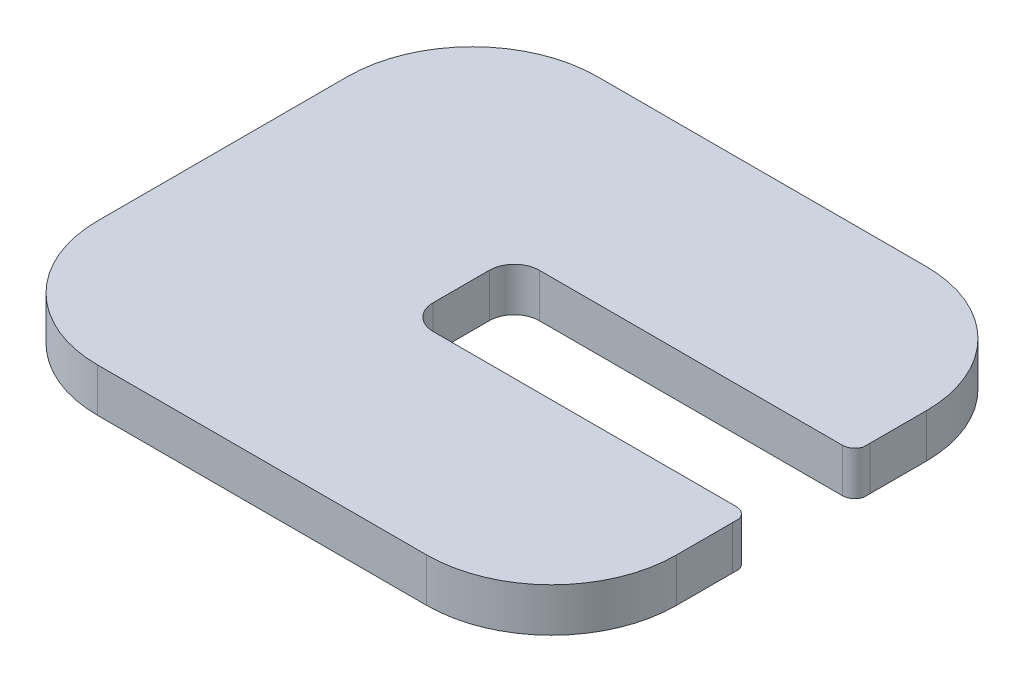
from build123d import *

# Parameters (mm, degrees)
BOSS_EXTRUDE1_DEPTH = 0.35
FILLET1_R           = 0.1
BOSS_EXTRUDE3_DEPTH = 0.35


with BuildPart() as part:
    # Sketch1 → Boss-Extrude1 (new body)
    with BuildSketch(Plane(origin=(0, 0, 0), x_dir=(1, 0, 0), z_dir=(0, 1, 0))):
        with BuildLine():
            Line((0, 0.225), (0, -0.225))
            ThreePointArc((0, -0.225), (0.058578644, -0.366421356), (0.2, -0.425))
            Line((0.2, -0.425), (3, -0.425))
            Line((3, -0.425), (1.614359354, -1.225))
            Line((1.614359354, -1.225), (-0.385640646, -1.225))
            Line((-0.385640646, -1.225), (-1.110640646, -0.5))
            Line((-1.110640646, -0.5), (-1.410640646, -0.5))
            ThreePointArc((-1.410640646, -0.5), (-1.910640646, 0), (-1.410640646, 0.5))
            Line((-1.410640646, 0.5), (-1.110640646, 0.5))
            Line((-1.110640646, 0.5), (-0.385640646, 1.225))
            Line((-0.385640646, 1.225), (1.614359354, 1.225))
            Line((1.614359354, 1.225), (3, 0.425))
            Line((3, 0.425), (0.2, 0.425))
            ThreePointArc((0.2, 0.425), (0.058578644, 0.366421356), (0, 0.225))
        make_face()
    extrude(amount=BOSS_EXTRUDE1_DEPTH)

    # Fillet1
    fillet1_edges = [part.edges().sort_by_distance(p)[0] for p in [
        (3, 0.175, -0.425),
        (3, 0.175, 0.425),
    ]]
    fillet(fillet1_edges, radius=FILLET1_R)

    # Sketch3 → Boss-Extrude3 (add)
    with BuildSketch(Plane(origin=(0, 0.35, 0), x_dir=(1, 0, 0), z_dir=(0, 1, 0))):
        with BuildLine():
            Line((2.723387502, 0.499118095), (2.723387502, 1))
            ThreePointArc((2.723387502, 1), (2.430494283, 1.707106781), (1.723387502, 2))
            Line((1.723387502, 2), (-0.910640646, 2))
            ThreePointArc((-0.910640646, 2), (-1.617747427, 1.707106781), (-1.910640646, 1))
            Line((-1.910640646, 1), (-1.910640646, -1))
            ThreePointArc((-1.910640646, -1), (-1.617747427, -1.707106781), (-0.910640646, -2))
            Line((-0.910640646, -2), (1.723387502, -2))
            ThreePointArc((1.723387502, -2), (2.430494283, -1.707106781), (2.723387502, -1))
            Line((2.723387502, -1), (2.723387502, -0.499118095))
            Line((2.723387502, -0.499118095), (-0.276612498, -0.499118095))
            Line((-0.276612498, -0.499118095), (-0.276612498, 0.499118095))
            Line((-0.276612498, 0.499118095), (2.723387502, 0.499118095))
        make_face()
    extrude(amount=-BOSS_EXTRUDE3_DEPTH)


solid = part.part
